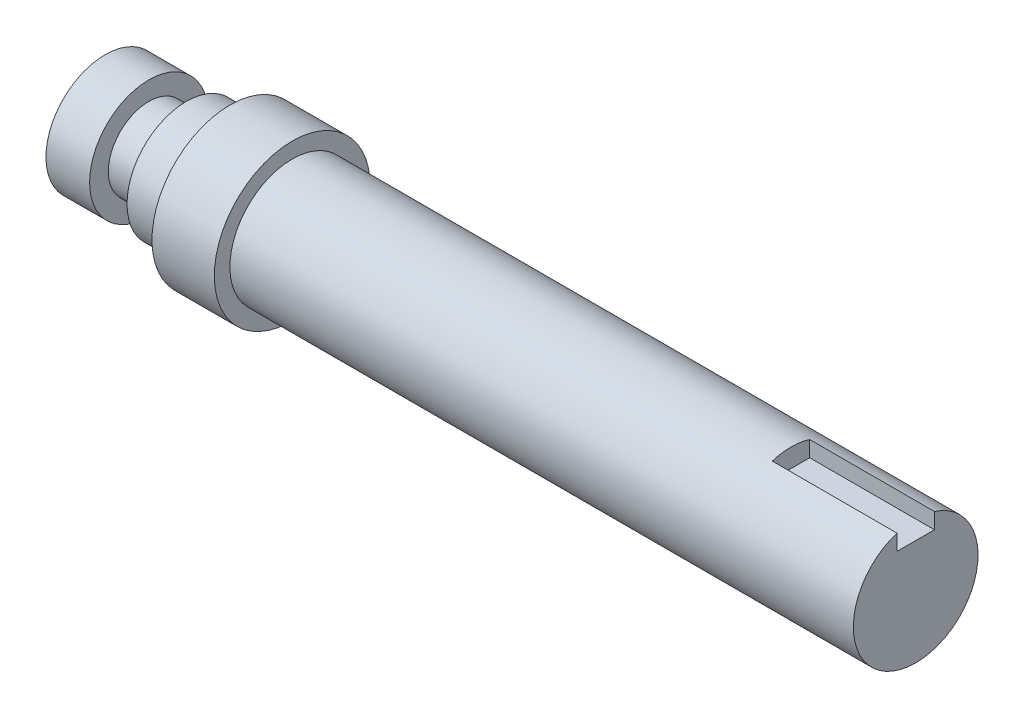
from build123d import *

# Parameters (mm, degrees)
SKETCH2_W          = 6
SKETCH2_H          = 3
SKETCH3_W          = 20
SKETCH3_H          = 5
CUT_EXTRUDE1_DEPTH = 3


with BuildPart() as part:
    # Sketch1 → Revolve1 (revolve)
    with BuildSketch(Plane.XY):
        Polygon((0, 0), (-130, 0), (-130, 9.5), (-110, 9.5), (-110, 12.5), (-100, 12.5), (-100, 10), (0, 10), align=None)
    revolve(axis=Axis((0, 0, 0), (-1, 0, 0)))

    # Sketch2 → Cut-Revolve1 (revolve, cut)
    with BuildSketch(Plane.XY):
        with Locations((-120, 8)):
            Rectangle(SKETCH2_W, SKETCH2_H)
    revolve(axis=Axis((-130, 0, 0), (1, 0, 0)), mode=Mode.SUBTRACT)

    # Sketch3 → Cut-Extrude1 (cut, symmetric)
    with BuildSketch(Plane.XY):
        with Locations((-10, 9.5)):
            Rectangle(SKETCH3_W, SKETCH3_H)
    extrude(amount=CUT_EXTRUDE1_DEPTH, both=True, mode=Mode.SUBTRACT)


solid = part.part
